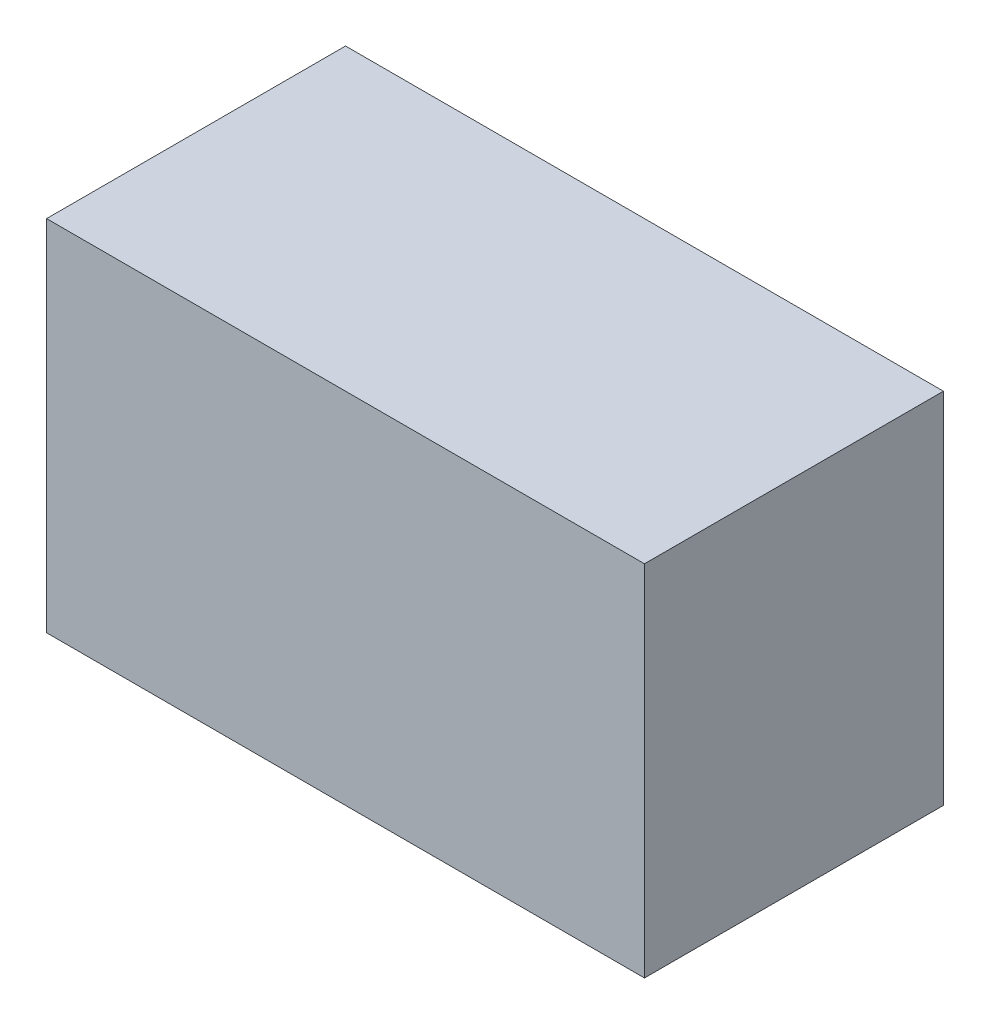
from build123d import *

# Parameters (mm, degrees)
ESQUISSE1_W        = 100
ESQUISSE1_H        = 60
BOSS_EXTRU_1_DEPTH = 50


with BuildPart() as part:
    # Esquisse1 → Boss.-Extru.1 (new body)
    with BuildSketch(Plane.XY):
        with Locations((50, 30)):
            Rectangle(ESQUISSE1_W, ESQUISSE1_H)
    extrude(amount=BOSS_EXTRU_1_DEPTH)


solid = part.part
